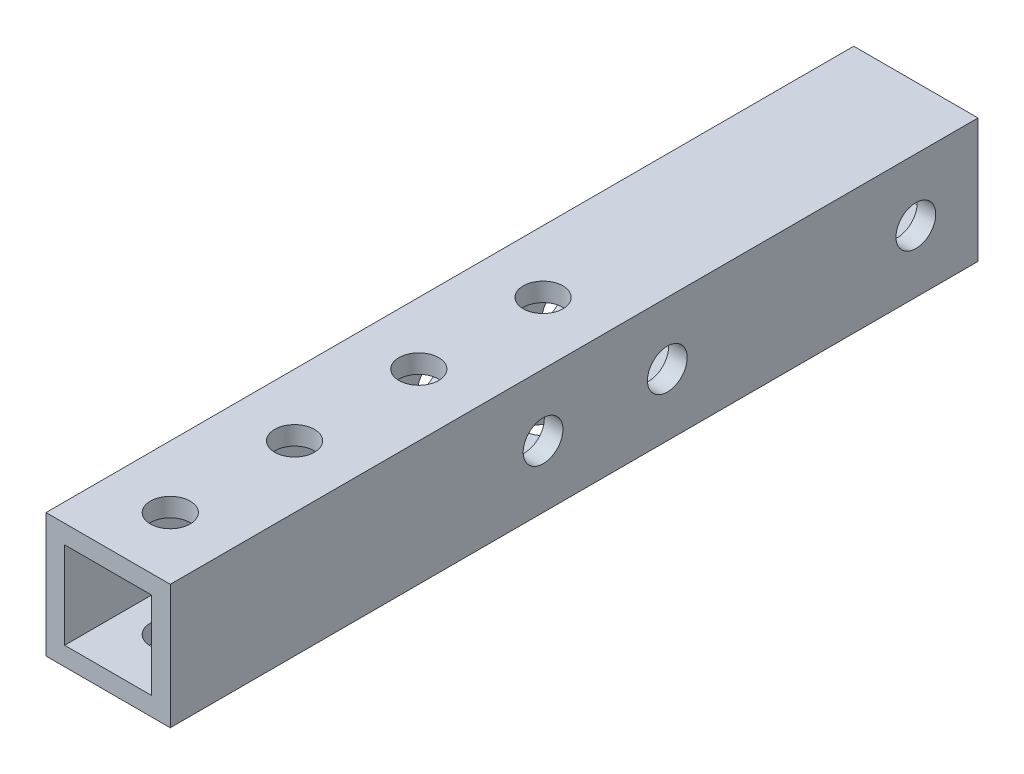
from build123d import *

# Parameters (mm, degrees)
SKETCH_1_W          = 10
SKETCH_1_H          = 10
SKETCH_1_W_2        = 7
SKETCH_1_H_2        = 7
EXTRUDE_1_DEPTH     = 65
SKETCH_3_R          = 1.6
CUT_EXTRUDE_1_DEPTH = 66.954529791
SKETCH_4_R          = 1.6
CUT_EXTRUDE_2_DEPTH = 66.954529791
SKETCH_5_R          = 1.6
CUT_EXTRUDE_3_DEPTH = 66.954529791


with BuildPart() as part:
    # ｽｹｯﾁ1 → 押し出し-薄板1 (new body)
    with BuildSketch(Plane.XY):
        Rectangle(SKETCH_1_W, SKETCH_1_H)
        Rectangle(SKETCH_1_W_2, SKETCH_1_H_2, mode=Mode.SUBTRACT)
    extrude(amount=EXTRUDE_1_DEPTH)

    # ｽｹｯﾁ3 → ｶｯﾄ - 押し出し1 (cut, through all)
    with BuildSketch(Plane.ZY.offset(5)):
        with Locations((5, 0)):
            Circle(SKETCH_3_R)
        with Locations((25, 0)):
            Circle(SKETCH_3_R)
    extrude(amount=-CUT_EXTRUDE_1_DEPTH, mode=Mode.SUBTRACT)

    # ｽｹｯﾁ4 → ｶｯﾄ - 押し出し2 (cut, through all)
    with BuildSketch(Plane.XZ.offset(5)):
        with Locations(Location((0, 30, 0), (0, 0, 270))):
            Circle(SKETCH_4_R)
        with Locations(Location((0, 40, 0), (0, 0, 270))):
            Circle(SKETCH_4_R)
        with Locations(Location((0, 50, 0), (0, 0, 270))):
            Circle(SKETCH_4_R)
        with Locations(Location((0, 60, 0), (0, 0, 270))):
            Circle(SKETCH_4_R)
    extrude(amount=-CUT_EXTRUDE_2_DEPTH, mode=Mode.SUBTRACT)

    # ｽｹｯﾁ5 → ｶｯﾄ - 押し出し3 (cut, through all)
    with BuildSketch(Plane(origin=(5, 0, 0), x_dir=(0, 0, -1), z_dir=(1, 0, 0))):
        with Locations((-35, 0)):
            Circle(SKETCH_5_R)
    extrude(amount=-CUT_EXTRUDE_3_DEPTH, mode=Mode.SUBTRACT)


solid = part.part
